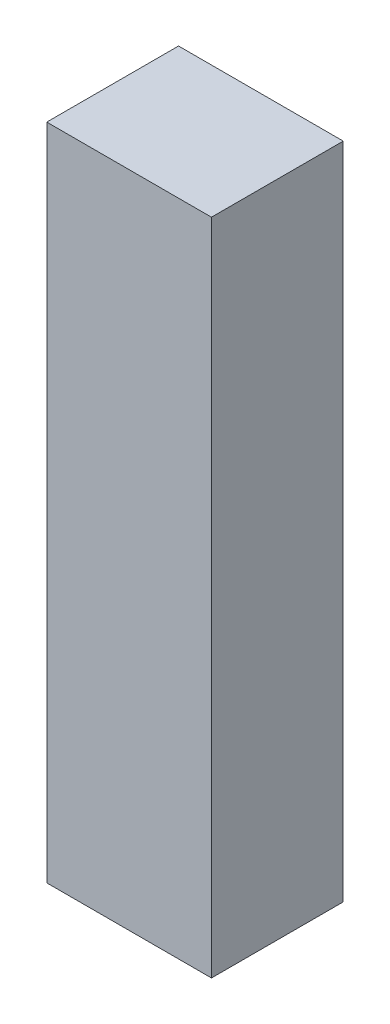
from build123d import *

# Parameters (mm, degrees)
TOPPING_ARKA_DUVAR_PANO_SURUCU_5_1_START = -736
SKETCH1_W                                = 50
SKETCH1_H                                = 200
TOPPING_ARKA_DUVAR_PANO_SURUCU_5_1_DEPTH = 40


with BuildPart() as part:
    # Sketch1 → TOPPING_arka_duvar_pano_surucu_5_1 (new body)
    with BuildSketch(Plane.XY.offset(TOPPING_ARKA_DUVAR_PANO_SURUCU_5_1_START)):
        with Locations((465, 430)):
            Rectangle(SKETCH1_W, SKETCH1_H)
    extrude(amount=-TOPPING_ARKA_DUVAR_PANO_SURUCU_5_1_DEPTH)


solid = part.part
